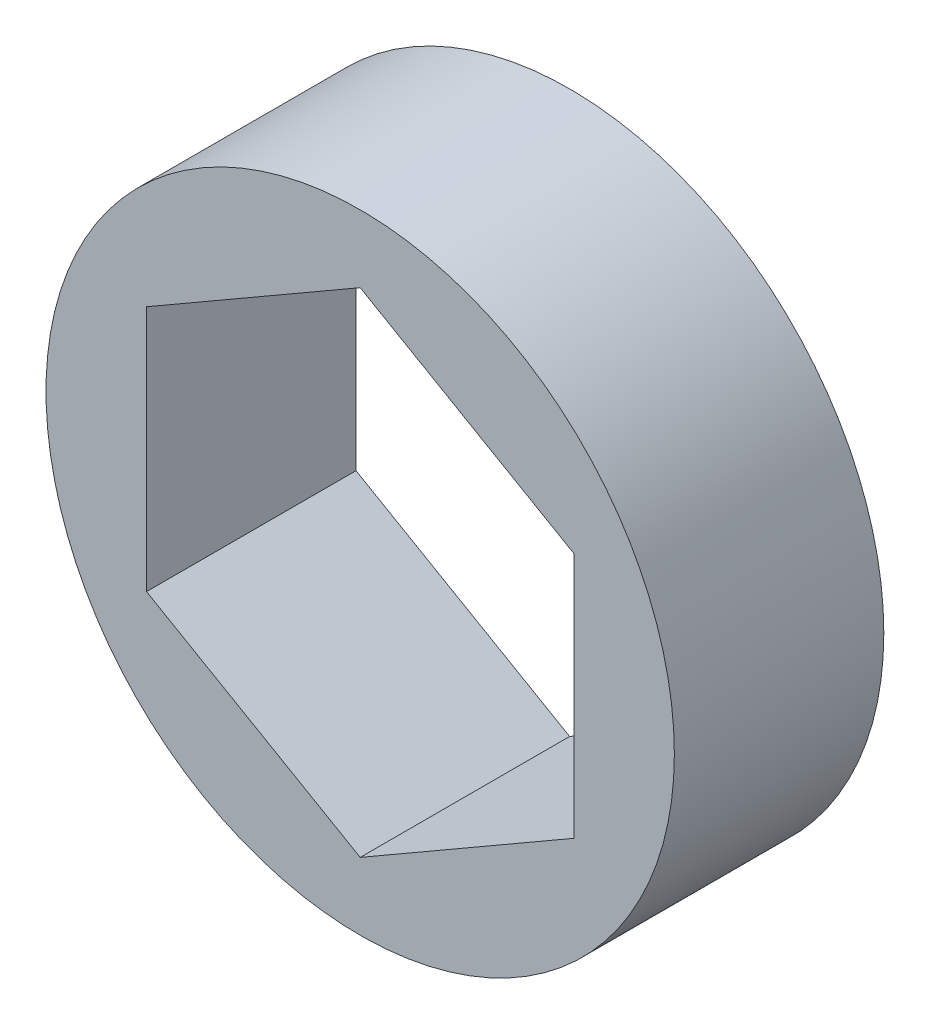
from build123d import *

# Parameters (mm, degrees)
SKETCH1_R           = 9.525
BOSS_EXTRUDE1_DEPTH = 3.175


with BuildPart() as part:
    # Sketch1 → Boss-Extrude1 (new, symmetric)
    with BuildSketch(Plane.XY):
        Circle(SKETCH1_R)
        Polygon((0, 7.478995387), (-6.477, 3.739497694), (-6.477, -3.739497694), (0, -7.478995387), (6.477, -3.739497694), (6.477, 3.739497694), align=None, mode=Mode.SUBTRACT)
    extrude(amount=BOSS_EXTRUDE1_DEPTH, both=True)


solid = part.part
